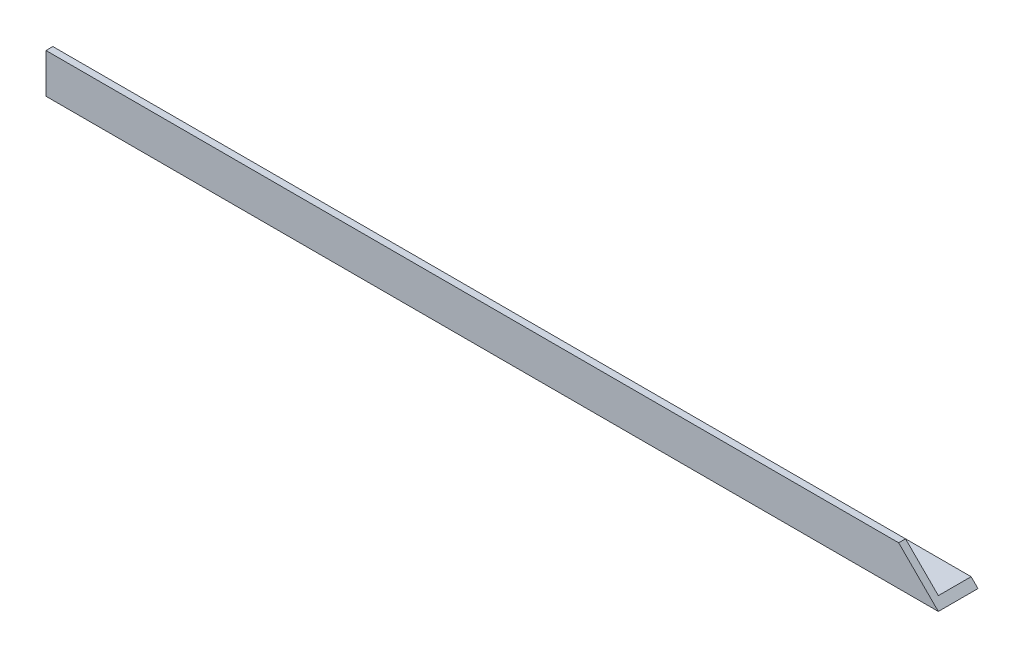
from build123d import *

# Parameters (mm, degrees)
BOSS_EXTRUDE1_DEPTH = 450
CUT_EXTRUDE1_DEPTH  = 451.888012704


with BuildPart() as part:
    # Sketch1 → Boss-Extrude1 (new body)
    with BuildSketch(Plane(origin=(0, 0, 0), x_dir=(0, 0, -1), z_dir=(1, 0, 0))):
        Polygon((0, 0), (20, 0), (20, 3.461178467), (3.461178467, 3.461178467), (3.461178467, 20), (0, 20), align=None)
    extrude(amount=BOSS_EXTRUDE1_DEPTH)

    # Sketch2 → Cut-Extrude1 (cut, through all)
    with BuildSketch(Plane(origin=(0, 0, 0), x_dir=(1, 0, 0), z_dir=(0, 0, -1))):
        Polygon((450, 0), (430, -20), (450, -20), align=None)
    extrude(amount=CUT_EXTRUDE1_DEPTH, mode=Mode.SUBTRACT)


solid = part.part
